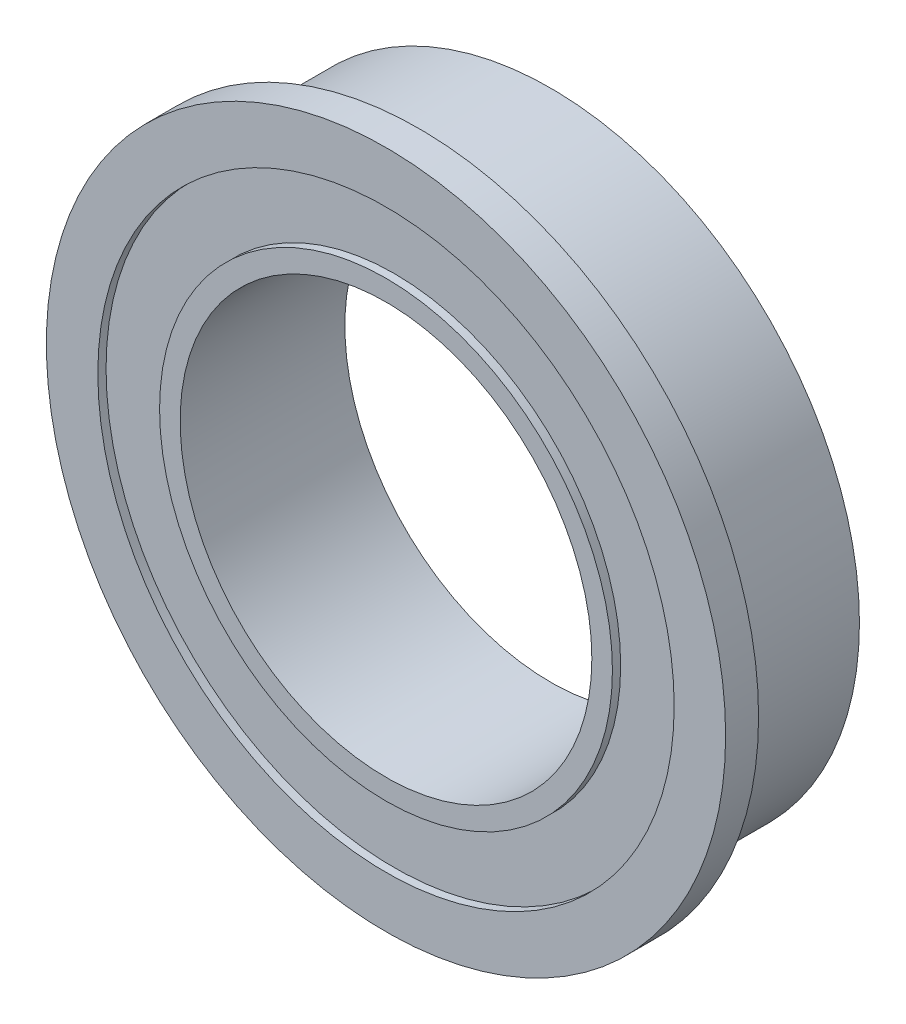
from build123d import *

# Parameters (mm, degrees)
SKETCH_1_R          = 8.25
SKETCH_1_R_2        = 7.5
EXTRUDE_1_DEPTH     = 0.8
EXTRUDE_START       = -4
SKETCH_2_R          = 7.5
SKETCH_2_R_2        = 5
EXTRUDE_2_DEPTH     = 4
SKETCH_3_R          = 7
SKETCH_3_R_2        = 5.5
CUT_EXTRUDE_1_DEPTH = 0.2


with BuildPart() as part:
    # 草图1 → 凸台-拉伸1 (new body)
    with BuildSketch(Plane.XY):
        Circle(SKETCH_1_R)
        Circle(SKETCH_1_R_2, mode=Mode.SUBTRACT)
    extrude(amount=EXTRUDE_1_DEPTH)

    # 草图2 → 凸台-拉伸2 (add)
    with BuildSketch(Plane.XY.offset(0.8).offset(EXTRUDE_START)):
        Circle(SKETCH_2_R)
        Circle(SKETCH_2_R_2, mode=Mode.SUBTRACT)
    extrude(amount=EXTRUDE_2_DEPTH)

    # 草图3 → 切除-拉伸1 (cut)
    with BuildSketch(Plane(origin=(0, 0, -3.2), x_dir=(-1, 0, 0), z_dir=(0, 0, -1))):
        Circle(SKETCH_3_R)
        Circle(SKETCH_3_R_2, mode=Mode.SUBTRACT)
    cut_extrude_1 = extrude(amount=-CUT_EXTRUDE_1_DEPTH, mode=Mode.SUBTRACT)

    # 镜向1: 切除-拉伸1 across plane
    add(cut_extrude_1.mirror(Plane(origin=(0, 0, -1.2), x_dir=(1, 0, 0), z_dir=(0, 0, -1))), mode=Mode.SUBTRACT)


solid = part.part
